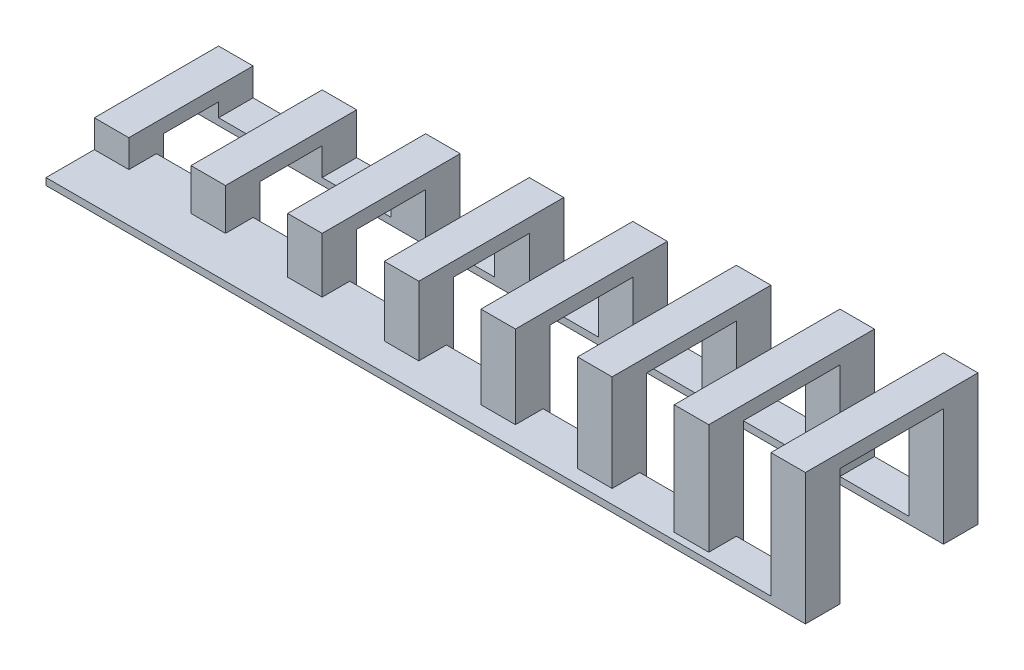
from build123d import *

# Parameters (mm, degrees)
SKETCH1_W          = 110
SKETCH1_H          = 25
BASE_DEPTH         = 1
SKETCH10_W         = 5
SKETCH10_H         = 5
LEG1_DEPTH         = 4
LEG2_W             = 5
LEG2_H             = 5
LEG2E_DEPTH        = 6
LEG3_W             = 5
LEG3_H             = 5
LEG3E_DEPTH        = 8
LEG4_W             = 5
LEG4_H             = 5
LEG4E_DEPTH        = 10
LEG5_W             = 5
LEG5_H             = 5
LEG5E_DEPTH        = 12
LEG6_W             = 5
LEG6_H             = 5
LEG6E_DEPTH        = 14
LEG7_W             = 5
LEG7_H             = 5
LEG7E_DEPTH        = 16
LEG8_W             = 5
LEG8_H             = 5
LEG8E_DEPTH        = 18
SKETCH29_W         = 5
SKETCH29_H         = 2
BRIDGE1_DEPTH      = 8
SKETCH30_W         = 5
SKETCH30_H         = 2
BRIDGE2_DEPTH      = 9
SKETCH31_W         = 5
SKETCH31_H         = 2
BRIDGE3_DEPTH      = 10
SKETCH32_W         = 5
SKETCH32_H         = 2
BRIDGE4_DEPTH      = 11
SKETCH33_W         = 5
SKETCH33_H         = 2
BRIDGE5_DEPTH      = 12
SKETCH34_W         = 5
SKETCH34_H         = 2
BRIDGE6_DEPTH      = 13
SKETCH35_W         = 5
SKETCH35_H         = 2
BRIDGE7_DEPTH      = 14
SKETCH36_W         = 5
SKETCH36_H         = 2
BRIDGE8_DEPTH      = 15
CUT_EXTRUDE4_DEPTH = 115.232219623


with BuildPart() as part:
    # Sketch1 → Base (new body)
    with BuildSketch(Plane(origin=(0, 0, 0), x_dir=(1, 0, 0), z_dir=(0, 1, 0))):
        with Locations((55, 12.5)):
            Rectangle(SKETCH1_W, SKETCH1_H)
    extrude(amount=BASE_DEPTH)

    # Sketch10 → leg1 (add)
    with BuildSketch(Plane(origin=(0, 1, 0), x_dir=(1, 0, 0), z_dir=(0, 1, 0))):
        with Locations((2.5, 22.5)):
            Rectangle(SKETCH10_W, SKETCH10_H)
        with Locations((2.5, 9.5)):
            Rectangle(SKETCH10_W, SKETCH10_H)
    extrude(amount=LEG1_DEPTH)

    # leg2 → leg2e (add)
    with BuildSketch(Plane(origin=(0, 1, 0), x_dir=(1, 0, 0), z_dir=(0, 1, 0))):
        with Locations((17.5, 22.5)):
            Rectangle(LEG2_W, LEG2_H)
        with Locations((17.5, 8.5)):
            Rectangle(LEG2_W, LEG2_H)
    extrude(amount=LEG2E_DEPTH)

    # leg3 → leg3e (add)
    with BuildSketch(Plane(origin=(0, 1, 0), x_dir=(1, 0, 0), z_dir=(0, 1, 0))):
        with Locations((32.5, 22.5)):
            Rectangle(LEG3_W, LEG3_H)
        with Locations((32.5, 7.5)):
            Rectangle(LEG3_W, LEG3_H)
    extrude(amount=LEG3E_DEPTH)

    # leg4 → leg4e (add)
    with BuildSketch(Plane(origin=(0, 1, 0), x_dir=(1, 0, 0), z_dir=(0, 1, 0))):
        with Locations((47.5, 22.5)):
            Rectangle(LEG4_W, LEG4_H)
        with Locations((47.5, 6.5)):
            Rectangle(LEG4_W, LEG4_H)
    extrude(amount=LEG4E_DEPTH)

    # leg5 → leg5e (add)
    with BuildSketch(Plane(origin=(0, 1, 0), x_dir=(1, 0, 0), z_dir=(0, 1, 0))):
        with Locations((62.5, 22.5)):
            Rectangle(LEG5_W, LEG5_H)
        with Locations((62.5, 5.5)):
            Rectangle(LEG5_W, LEG5_H)
    extrude(amount=LEG5E_DEPTH)

    # leg6 → leg6e (add)
    with BuildSketch(Plane(origin=(0, 1, 0), x_dir=(1, 0, 0), z_dir=(0, 1, 0))):
        with Locations((77.5, 22.5)):
            Rectangle(LEG6_W, LEG6_H)
        with Locations((77.5, 4.5)):
            Rectangle(LEG6_W, LEG6_H)
    extrude(amount=LEG6E_DEPTH)

    # leg7 → leg7e (add)
    with BuildSketch(Plane(origin=(0, 1, 0), x_dir=(1, 0, 0), z_dir=(0, 1, 0))):
        with Locations((92.5, 22.5)):
            Rectangle(LEG7_W, LEG7_H)
        with Locations((92.5, 3.5)):
            Rectangle(LEG7_W, LEG7_H)
    extrude(amount=LEG7E_DEPTH)

    # leg8 → leg8e (add)
    with BuildSketch(Plane(origin=(0, 1, 0), x_dir=(1, 0, 0), z_dir=(0, 1, 0))):
        with Locations((107.5, 22.5)):
            Rectangle(LEG8_W, LEG8_H)
        with Locations((107.5, 2.5)):
            Rectangle(LEG8_W, LEG8_H)
    extrude(amount=LEG8E_DEPTH)

    # Sketch29 → bridge1 (add)
    with BuildSketch(Plane.XY.offset(-20)):
        with Locations((2.5, 4)):
            Rectangle(SKETCH29_W, SKETCH29_H)
    extrude(amount=BRIDGE1_DEPTH)

    # Sketch30 → bridge2 (add)
    with BuildSketch(Plane.XY.offset(-20)):
        with Locations((17.5, 6)):
            Rectangle(SKETCH30_W, SKETCH30_H)
    extrude(amount=BRIDGE2_DEPTH)

    # Sketch31 → bridge3 (add)
    with BuildSketch(Plane.XY.offset(-20)):
        with Locations((32.5, 8)):
            Rectangle(SKETCH31_W, SKETCH31_H)
    extrude(amount=BRIDGE3_DEPTH)

    # Sketch32 → bridge4 (add)
    with BuildSketch(Plane.XY.offset(-20)):
        with Locations((47.5, 10)):
            Rectangle(SKETCH32_W, SKETCH32_H)
    extrude(amount=BRIDGE4_DEPTH)

    # Sketch33 → bridge5 (add)
    with BuildSketch(Plane.XY.offset(-20)):
        with Locations((62.5, 12)):
            Rectangle(SKETCH33_W, SKETCH33_H)
    extrude(amount=BRIDGE5_DEPTH)

    # Sketch34 → bridge6 (add)
    with BuildSketch(Plane.XY.offset(-20)):
        with Locations((77.5, 14)):
            Rectangle(SKETCH34_W, SKETCH34_H)
    extrude(amount=BRIDGE6_DEPTH)

    # Sketch35 → bridge7 (add)
    with BuildSketch(Plane.XY.offset(-20)):
        with Locations((92.5, 16)):
            Rectangle(SKETCH35_W, SKETCH35_H)
    extrude(amount=BRIDGE7_DEPTH)

    # Sketch36 → bridge8 (add)
    with BuildSketch(Plane.XY.offset(-20)):
        with Locations((107.5, 18)):
            Rectangle(SKETCH36_W, SKETCH36_H)
    extrude(amount=BRIDGE8_DEPTH)

    # Sketch37 → Cut-Extrude4 (cut, through all)
    with BuildSketch(Plane(origin=(0, 1, 0), x_dir=(1, 0, 0), z_dir=(0, 1, 0))):
        Polygon((0, 20), (110, 20), (110, 5), (95, 5), (95, 6), (80, 6), (80, 7), (65, 7), (65, 8), (50, 8), (50, 9), (35, 9), (35, 10), (20, 10), (20, 11), (5, 11), (5, 12), (0, 12), align=None)
    extrude(amount=-CUT_EXTRUDE4_DEPTH, mode=Mode.SUBTRACT)


solid = part.part
